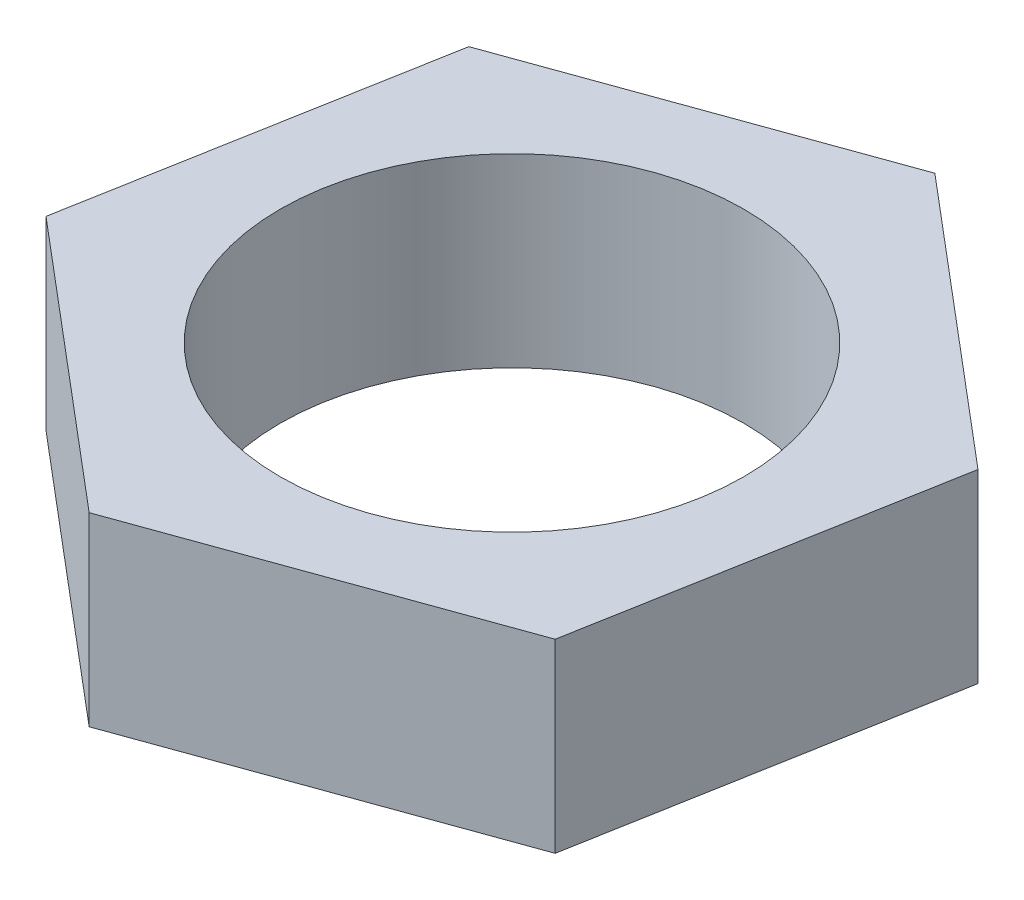
from build123d import *

# Parameters (mm, degrees)
SKETCH_1_R      = 2.5
EXTRUDE_1_DEPTH = 2


with BuildPart() as part:
    # 草图1 → 凸台-拉伸1 (new body)
    with BuildSketch(Plane(origin=(0, 0, 0), x_dir=(1, 0, 0), z_dir=(0, 1, 0))):
        Polygon((3.695041723, 1.330768282), (0.695041723, 3.865384141), (-3, 2.534615859), (-3.695041723, -1.330768282), (-0.695041723, -3.865384141), (3, -2.534615859), align=None)
        with Locations(Location((0, 0, 0), (0, 0, 270))):
            Circle(SKETCH_1_R, mode=Mode.SUBTRACT)
    extrude(amount=EXTRUDE_1_DEPTH)


solid = part.part
